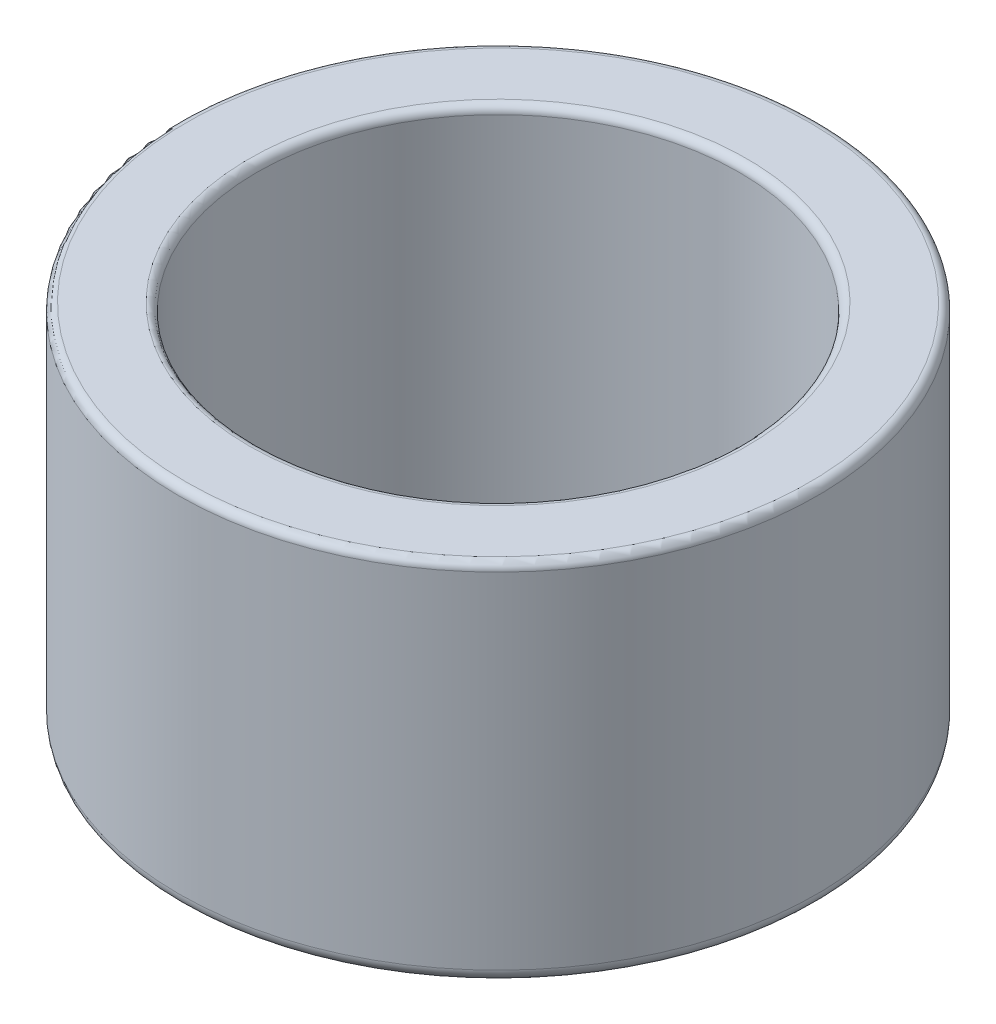
from build123d import *

# Parameters (mm, degrees)
SKETCH1_R           = 12.230985
SKETCH1_R_2         = 9.230985
BOSS_EXTRUDE1_DEPTH = 14
FILLET1_R           = 0.3
FILLET5_R           = 0.3
FILLET6_R           = 0.5
FILLET7_R           = 0.5


with BuildPart() as part:
    # Sketch1 → Boss-Extrude1 (new body)
    with BuildSketch(Plane(origin=(0, 0, 0), x_dir=(1, 0, 0), z_dir=(0, 1, 0))):
        with Locations(Location((0, 0, 0), (0, 0, 270))):
            Circle(SKETCH1_R)
        with Locations(Location((0, 0, 0), (0, 0, 270))):
            Circle(SKETCH1_R_2, mode=Mode.SUBTRACT)
    extrude(amount=BOSS_EXTRUDE1_DEPTH)

    # Fillet1
    fillet1_edges = [part.edges().sort_by_distance(p)[0] for p in [
        (0, 14, -12.230985),
    ]]
    fillet(fillet1_edges, radius=FILLET1_R)

    # Fillet5
    fillet5_edges = [part.edges().sort_by_distance(p)[0] for p in [
        (0, 14, -9.230985),
    ]]
    fillet(fillet5_edges, radius=FILLET5_R)

    # Fillet6
    fillet6_edges = [part.edges().sort_by_distance(p)[0] for p in [
        (0, 0, -12.230985),
    ]]
    fillet(fillet6_edges, radius=FILLET6_R)

    # Fillet7
    fillet7_edges = [part.edges().sort_by_distance(p)[0] for p in [
        (0, 0, -9.230985),
    ]]
    fillet(fillet7_edges, radius=FILLET7_R)


solid = part.part
